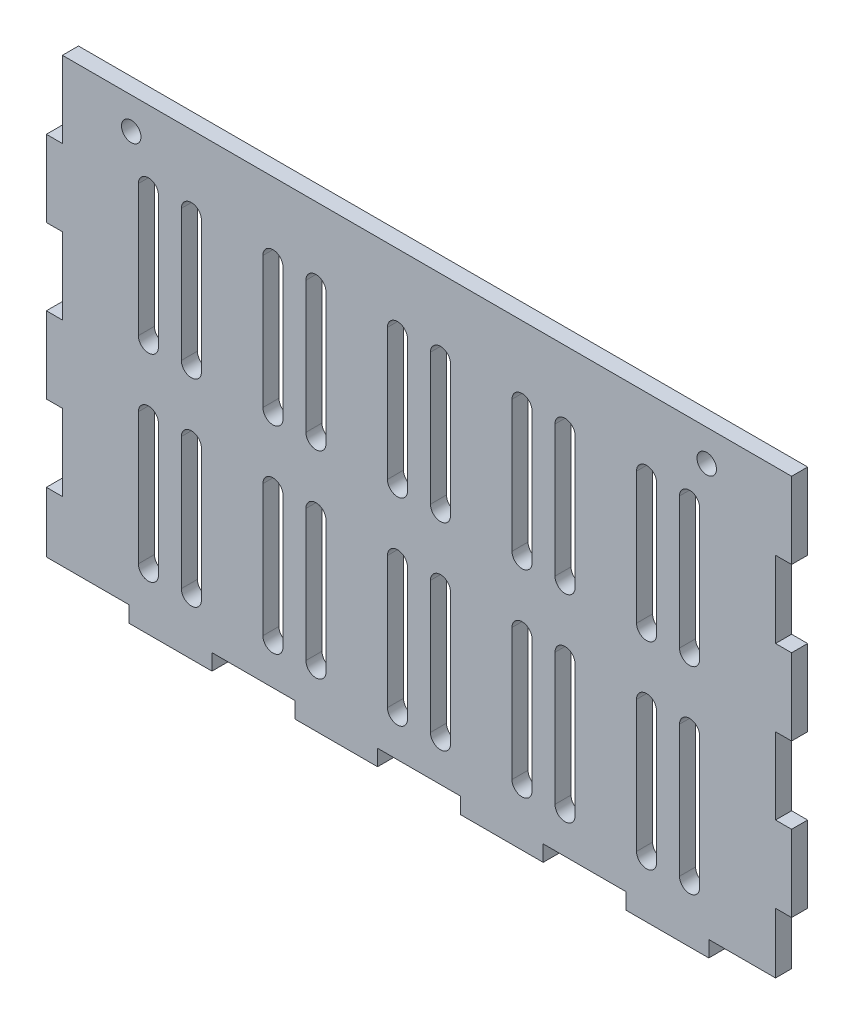
from build123d import *

# Parameters (mm, degrees)
SKETCH1_W           = 130
SKETCH1_H           = 80
BOSS_EXTRUDE1_DEPTH = 2.8
SKETCH2_W           = 14.444444444
SKETCH2_H           = 2.8
SKETCH2_W_2         = 2.8
SKETCH2_H_2         = 13.333333334
SKETCH2_H_3         = 13.333333333
CUT_EXTRUDE1_DEPTH  = 153.669053839
CUT_EXTRUDE2_REACH  = 154.669
SKETCH3_R           = 1.7
CUT_EXTRUDE3_REACH  = 154.669


with BuildPart() as part:
    # Sketch1 → Boss-Extrude1 (new body)
    with BuildSketch(Plane.XY):
        with Locations((65, 40)):
            Rectangle(SKETCH1_W, SKETCH1_H)
    extrude(amount=BOSS_EXTRUDE1_DEPTH)

    # Sketch2 → Cut-Extrude1 (cut, through all)
    with BuildSketch(Plane.XY.offset(2.8)):
        with Locations((7.222222222, 1.4)):
            Rectangle(SKETCH2_W, SKETCH2_H)
        with Locations((36.111111111, 1.4)):
            Rectangle(SKETCH2_W, SKETCH2_H)
        with Locations((65, 1.4)):
            Rectangle(SKETCH2_W, SKETCH2_H)
        with Locations((93.888888889, 1.4)):
            Rectangle(SKETCH2_W, SKETCH2_H)
        Polygon((115.555555556, 0), (115.555555556, 2.8), (127.2, 2.8), (127.2, 13.333333333), (130, 13.333333333), (130, 0), align=None)
        with Locations((1.4, 20)):
            Rectangle(SKETCH2_W_2, SKETCH2_H_2)
        with Locations((1.4, 46.666666667)):
            Rectangle(SKETCH2_W_2, SKETCH2_H_3)
        with Locations((1.4, 73.333333334)):
            Rectangle(SKETCH2_W_2, SKETCH2_H_3)
        with Locations((128.6, 33.333333334)):
            Rectangle(SKETCH2_W_2, SKETCH2_H_3)
        with Locations((128.6, 60)):
            Rectangle(SKETCH2_W_2, SKETCH2_H_2)
    extrude(amount=-CUT_EXTRUDE1_DEPTH, mode=Mode.SUBTRACT)

    # Sketch3 → Cut-Extrude2 (cut, up to next)
    with BuildSketch(Plane.XY.offset(2.8), mode=Mode.PRIVATE) as cut_extrude2_sk1:
        with Locations((14.8, 74.5)):
            Circle(SKETCH3_R)
    cut_extrude2_tool1 = extrude(cut_extrude2_sk1.sketch, amount=-CUT_EXTRUDE2_REACH, mode=Mode.PRIVATE) & part.part
    # Sketch3 → Cut-Extrude2 (cut, up to next)
    with BuildSketch(Plane.XY.offset(2.8), mode=Mode.PRIVATE) as cut_extrude2_sk2:
        with Locations(Location((115.2, 74.5, 0), (0, 0, 180))):
            Circle(SKETCH3_R)
    cut_extrude2_tool2 = extrude(cut_extrude2_sk2.sketch, amount=-CUT_EXTRUDE2_REACH, mode=Mode.PRIVATE) & part.part
    add(cut_extrude2_tool1.solids().sort_by_distance((14.8, 74.5, 2.8))[0], mode=Mode.SUBTRACT)
    add(cut_extrude2_tool2.solids().sort_by_distance((115.2, 74.5, 2.8))[0], mode=Mode.SUBTRACT)

    # Sketch4 → Cut-Extrude3 (cut, up to next)
    with BuildSketch(Plane.XY.offset(2.8), mode=Mode.PRIVATE) as cut_extrude3_sk1:
        with BuildLine():
            Line((16.05, 9.8), (16.05, 32.775))
            ThreePointArc((16.05, 32.775), (17.8, 34.525), (19.55, 32.775))
            Line((19.55, 32.775), (19.55, 9.8))
            ThreePointArc((19.55, 9.8), (17.8, 8.05), (16.05, 9.8))
        make_face()
    cut_extrude3_tool1 = extrude(cut_extrude3_sk1.sketch, amount=-CUT_EXTRUDE3_REACH, mode=Mode.PRIVATE) & part.part
    # Sketch4 → Cut-Extrude3 (cut, up to next)
    with BuildSketch(Plane.XY.offset(2.8), mode=Mode.PRIVATE) as cut_extrude3_sk2:
        with BuildLine():
            Line((16.05, 44.275), (16.05, 67.25))
            ThreePointArc((16.05, 67.25), (17.8, 69), (19.55, 67.25))
            Line((19.55, 67.25), (19.55, 44.275))
            ThreePointArc((19.55, 44.275), (17.8, 42.525), (16.05, 44.275))
        make_face()
    cut_extrude3_tool2 = extrude(cut_extrude3_sk2.sketch, amount=-CUT_EXTRUDE3_REACH, mode=Mode.PRIVATE) & part.part
    # Sketch4 → Cut-Extrude3 (cut, up to next)
    with BuildSketch(Plane.XY.offset(2.8), mode=Mode.PRIVATE) as cut_extrude3_sk3:
        with BuildLine():
            Line((23.55, 9.8), (23.55, 32.775))
            ThreePointArc((23.55, 32.775), (25.3, 34.525), (27.05, 32.775))
            Line((27.05, 32.775), (27.05, 9.8))
            ThreePointArc((27.05, 9.8), (25.3, 8.05), (23.55, 9.8))
        make_face()
    cut_extrude3_tool3 = extrude(cut_extrude3_sk3.sketch, amount=-CUT_EXTRUDE3_REACH, mode=Mode.PRIVATE) & part.part
    # Sketch4 → Cut-Extrude3 (cut, up to next)
    with BuildSketch(Plane.XY.offset(2.8), mode=Mode.PRIVATE) as cut_extrude3_sk4:
        with BuildLine():
            Line((23.55, 44.275), (23.55, 67.25))
            ThreePointArc((23.55, 67.25), (25.3, 69), (27.05, 67.25))
            Line((27.05, 67.25), (27.05, 44.275))
            ThreePointArc((27.05, 44.275), (25.3, 42.525), (23.55, 44.275))
        make_face()
    cut_extrude3_tool4 = extrude(cut_extrude3_sk4.sketch, amount=-CUT_EXTRUDE3_REACH, mode=Mode.PRIVATE) & part.part
    # Sketch4 → Cut-Extrude3 (cut, up to next)
    with BuildSketch(Plane.XY.offset(2.8), mode=Mode.PRIVATE) as cut_extrude3_sk5:
        with BuildLine():
            Line((41.275, 9.8), (41.275, 32.775))
            ThreePointArc((41.275, 32.775), (39.525, 34.525), (37.775, 32.775))
            Line((37.775, 32.775), (37.775, 9.8))
            ThreePointArc((37.775, 9.8), (39.525, 8.05), (41.275, 9.8))
        make_face()
    cut_extrude3_tool5 = extrude(cut_extrude3_sk5.sketch, amount=-CUT_EXTRUDE3_REACH, mode=Mode.PRIVATE) & part.part
    # Sketch4 → Cut-Extrude3 (cut, up to next)
    with BuildSketch(Plane.XY.offset(2.8), mode=Mode.PRIVATE) as cut_extrude3_sk6:
        with BuildLine():
            Line((48.775, 9.8), (48.775, 32.775))
            ThreePointArc((48.775, 32.775), (47.025, 34.525), (45.275, 32.775))
            Line((45.275, 32.775), (45.275, 9.8))
            ThreePointArc((45.275, 9.8), (47.025, 8.05), (48.775, 9.8))
        make_face()
    cut_extrude3_tool6 = extrude(cut_extrude3_sk6.sketch, amount=-CUT_EXTRUDE3_REACH, mode=Mode.PRIVATE) & part.part
    # Sketch4 → Cut-Extrude3 (cut, up to next)
    with BuildSketch(Plane.XY.offset(2.8), mode=Mode.PRIVATE) as cut_extrude3_sk7:
        with BuildLine():
            Line((48.775, 44.275), (48.775, 67.25))
            ThreePointArc((48.775, 67.25), (47.025, 69), (45.275, 67.25))
            Line((45.275, 67.25), (45.275, 44.275))
            ThreePointArc((45.275, 44.275), (47.025, 42.525), (48.775, 44.275))
        make_face()
    cut_extrude3_tool7 = extrude(cut_extrude3_sk7.sketch, amount=-CUT_EXTRUDE3_REACH, mode=Mode.PRIVATE) & part.part
    # Sketch4 → Cut-Extrude3 (cut, up to next)
    with BuildSketch(Plane.XY.offset(2.8), mode=Mode.PRIVATE) as cut_extrude3_sk8:
        with BuildLine():
            Line((41.275, 44.275), (41.275, 67.25))
            ThreePointArc((41.275, 67.25), (39.525, 69), (37.775, 67.25))
            Line((37.775, 67.25), (37.775, 44.275))
            ThreePointArc((37.775, 44.275), (39.525, 42.525), (41.275, 44.275))
        make_face()
    cut_extrude3_tool8 = extrude(cut_extrude3_sk8.sketch, amount=-CUT_EXTRUDE3_REACH, mode=Mode.PRIVATE) & part.part
    # Sketch4 → Cut-Extrude3 (cut, up to next)
    with BuildSketch(Plane.XY.offset(2.8), mode=Mode.PRIVATE) as cut_extrude3_sk9:
        with BuildLine():
            Line((63, 9.8), (63, 32.775))
            ThreePointArc((63, 32.775), (61.25, 34.525), (59.5, 32.775))
            Line((59.5, 32.775), (59.5, 9.8))
            ThreePointArc((59.5, 9.8), (61.25, 8.05), (63, 9.8))
        make_face()
    cut_extrude3_tool9 = extrude(cut_extrude3_sk9.sketch, amount=-CUT_EXTRUDE3_REACH, mode=Mode.PRIVATE) & part.part
    # Sketch4 → Cut-Extrude3 (cut, up to next)
    with BuildSketch(Plane.XY.offset(2.8), mode=Mode.PRIVATE) as cut_extrude3_sk10:
        with BuildLine():
            Line((70.5, 9.8), (70.5, 32.775))
            ThreePointArc((70.5, 32.775), (68.75, 34.525), (67, 32.775))
            Line((67, 32.775), (67, 9.8))
            ThreePointArc((67, 9.8), (68.75, 8.05), (70.5, 9.8))
        make_face()
    cut_extrude3_tool10 = extrude(cut_extrude3_sk10.sketch, amount=-CUT_EXTRUDE3_REACH, mode=Mode.PRIVATE) & part.part
    # Sketch4 → Cut-Extrude3 (cut, up to next)
    with BuildSketch(Plane.XY.offset(2.8), mode=Mode.PRIVATE) as cut_extrude3_sk11:
        with BuildLine():
            Line((70.5, 44.275), (70.5, 67.25))
            ThreePointArc((70.5, 67.25), (68.75, 69), (67, 67.25))
            Line((67, 67.25), (67, 44.275))
            ThreePointArc((67, 44.275), (68.75, 42.525), (70.5, 44.275))
        make_face()
    cut_extrude3_tool11 = extrude(cut_extrude3_sk11.sketch, amount=-CUT_EXTRUDE3_REACH, mode=Mode.PRIVATE) & part.part
    # Sketch4 → Cut-Extrude3 (cut, up to next)
    with BuildSketch(Plane.XY.offset(2.8), mode=Mode.PRIVATE) as cut_extrude3_sk12:
        with BuildLine():
            Line((63, 44.275), (63, 67.25))
            ThreePointArc((63, 67.25), (61.25, 69), (59.5, 67.25))
            Line((59.5, 67.25), (59.5, 44.275))
            ThreePointArc((59.5, 44.275), (61.25, 42.525), (63, 44.275))
        make_face()
    cut_extrude3_tool12 = extrude(cut_extrude3_sk12.sketch, amount=-CUT_EXTRUDE3_REACH, mode=Mode.PRIVATE) & part.part
    # Sketch4 → Cut-Extrude3 (cut, up to next)
    with BuildSketch(Plane.XY.offset(2.8), mode=Mode.PRIVATE) as cut_extrude3_sk13:
        with BuildLine():
            Line((84.725, 9.8), (84.725, 32.775))
            ThreePointArc((84.725, 32.775), (82.975, 34.525), (81.225, 32.775))
            Line((81.225, 32.775), (81.225, 9.8))
            ThreePointArc((81.225, 9.8), (82.975, 8.05), (84.725, 9.8))
        make_face()
    cut_extrude3_tool13 = extrude(cut_extrude3_sk13.sketch, amount=-CUT_EXTRUDE3_REACH, mode=Mode.PRIVATE) & part.part
    # Sketch4 → Cut-Extrude3 (cut, up to next)
    with BuildSketch(Plane.XY.offset(2.8), mode=Mode.PRIVATE) as cut_extrude3_sk14:
        with BuildLine():
            Line((92.225, 9.8), (92.225, 32.775))
            ThreePointArc((92.225, 32.775), (90.475, 34.525), (88.725, 32.775))
            Line((88.725, 32.775), (88.725, 9.8))
            ThreePointArc((88.725, 9.8), (90.475, 8.05), (92.225, 9.8))
        make_face()
    cut_extrude3_tool14 = extrude(cut_extrude3_sk14.sketch, amount=-CUT_EXTRUDE3_REACH, mode=Mode.PRIVATE) & part.part
    # Sketch4 → Cut-Extrude3 (cut, up to next)
    with BuildSketch(Plane.XY.offset(2.8), mode=Mode.PRIVATE) as cut_extrude3_sk15:
        with BuildLine():
            Line((92.225, 44.275), (92.225, 67.25))
            ThreePointArc((92.225, 67.25), (90.475, 69), (88.725, 67.25))
            Line((88.725, 67.25), (88.725, 44.275))
            ThreePointArc((88.725, 44.275), (90.475, 42.525), (92.225, 44.275))
        make_face()
    cut_extrude3_tool15 = extrude(cut_extrude3_sk15.sketch, amount=-CUT_EXTRUDE3_REACH, mode=Mode.PRIVATE) & part.part
    # Sketch4 → Cut-Extrude3 (cut, up to next)
    with BuildSketch(Plane.XY.offset(2.8), mode=Mode.PRIVATE) as cut_extrude3_sk16:
        with BuildLine():
            Line((84.725, 44.275), (84.725, 67.25))
            ThreePointArc((84.725, 67.25), (82.975, 69), (81.225, 67.25))
            Line((81.225, 67.25), (81.225, 44.275))
            ThreePointArc((81.225, 44.275), (82.975, 42.525), (84.725, 44.275))
        make_face()
    cut_extrude3_tool16 = extrude(cut_extrude3_sk16.sketch, amount=-CUT_EXTRUDE3_REACH, mode=Mode.PRIVATE) & part.part
    # Sketch4 → Cut-Extrude3 (cut, up to next)
    with BuildSketch(Plane.XY.offset(2.8), mode=Mode.PRIVATE) as cut_extrude3_sk17:
        with BuildLine():
            Line((106.45, 9.8), (106.45, 32.775))
            ThreePointArc((106.45, 32.775), (104.7, 34.525), (102.95, 32.775))
            Line((102.95, 32.775), (102.95, 9.8))
            ThreePointArc((102.95, 9.8), (104.7, 8.05), (106.45, 9.8))
        make_face()
    cut_extrude3_tool17 = extrude(cut_extrude3_sk17.sketch, amount=-CUT_EXTRUDE3_REACH, mode=Mode.PRIVATE) & part.part
    # Sketch4 → Cut-Extrude3 (cut, up to next)
    with BuildSketch(Plane.XY.offset(2.8), mode=Mode.PRIVATE) as cut_extrude3_sk18:
        with BuildLine():
            Line((113.95, 9.8), (113.95, 32.775))
            ThreePointArc((113.95, 32.775), (112.2, 34.525), (110.45, 32.775))
            Line((110.45, 32.775), (110.45, 9.8))
            ThreePointArc((110.45, 9.8), (112.2, 8.05), (113.95, 9.8))
        make_face()
    cut_extrude3_tool18 = extrude(cut_extrude3_sk18.sketch, amount=-CUT_EXTRUDE3_REACH, mode=Mode.PRIVATE) & part.part
    # Sketch4 → Cut-Extrude3 (cut, up to next)
    with BuildSketch(Plane.XY.offset(2.8), mode=Mode.PRIVATE) as cut_extrude3_sk19:
        with BuildLine():
            Line((113.95, 44.275), (113.95, 67.25))
            ThreePointArc((113.95, 67.25), (112.2, 69), (110.45, 67.25))
            Line((110.45, 67.25), (110.45, 44.275))
            ThreePointArc((110.45, 44.275), (112.2, 42.525), (113.95, 44.275))
        make_face()
    cut_extrude3_tool19 = extrude(cut_extrude3_sk19.sketch, amount=-CUT_EXTRUDE3_REACH, mode=Mode.PRIVATE) & part.part
    # Sketch4 → Cut-Extrude3 (cut, up to next)
    with BuildSketch(Plane.XY.offset(2.8), mode=Mode.PRIVATE) as cut_extrude3_sk20:
        with BuildLine():
            Line((106.45, 44.275), (106.45, 67.25))
            ThreePointArc((106.45, 67.25), (104.7, 69), (102.95, 67.25))
            Line((102.95, 67.25), (102.95, 44.275))
            ThreePointArc((102.95, 44.275), (104.7, 42.525), (106.45, 44.275))
        make_face()
    cut_extrude3_tool20 = extrude(cut_extrude3_sk20.sketch, amount=-CUT_EXTRUDE3_REACH, mode=Mode.PRIVATE) & part.part
    add(cut_extrude3_tool1.solids().sort_by_distance((17.8, 21.2875, 2.8))[0], mode=Mode.SUBTRACT)
    add(cut_extrude3_tool2.solids().sort_by_distance((17.8, 55.7625, 2.8))[0], mode=Mode.SUBTRACT)
    add(cut_extrude3_tool3.solids().sort_by_distance((25.3, 21.2875, 2.8))[0], mode=Mode.SUBTRACT)
    add(cut_extrude3_tool4.solids().sort_by_distance((25.3, 55.7625, 2.8))[0], mode=Mode.SUBTRACT)
    add(cut_extrude3_tool5.solids().sort_by_distance((39.525, 21.2875, 2.8))[0], mode=Mode.SUBTRACT)
    add(cut_extrude3_tool6.solids().sort_by_distance((47.025, 21.2875, 2.8))[0], mode=Mode.SUBTRACT)
    add(cut_extrude3_tool7.solids().sort_by_distance((47.025, 55.7625, 2.8))[0], mode=Mode.SUBTRACT)
    add(cut_extrude3_tool8.solids().sort_by_distance((39.525, 55.7625, 2.8))[0], mode=Mode.SUBTRACT)
    add(cut_extrude3_tool9.solids().sort_by_distance((61.25, 21.2875, 2.8))[0], mode=Mode.SUBTRACT)
    add(cut_extrude3_tool10.solids().sort_by_distance((68.75, 21.2875, 2.8))[0], mode=Mode.SUBTRACT)
    add(cut_extrude3_tool11.solids().sort_by_distance((68.75, 55.7625, 2.8))[0], mode=Mode.SUBTRACT)
    add(cut_extrude3_tool12.solids().sort_by_distance((61.25, 55.7625, 2.8))[0], mode=Mode.SUBTRACT)
    add(cut_extrude3_tool13.solids().sort_by_distance((82.975, 21.2875, 2.8))[0], mode=Mode.SUBTRACT)
    add(cut_extrude3_tool14.solids().sort_by_distance((90.475, 21.2875, 2.8))[0], mode=Mode.SUBTRACT)
    add(cut_extrude3_tool15.solids().sort_by_distance((90.475, 55.7625, 2.8))[0], mode=Mode.SUBTRACT)
    add(cut_extrude3_tool16.solids().sort_by_distance((82.975, 55.7625, 2.8))[0], mode=Mode.SUBTRACT)
    add(cut_extrude3_tool17.solids().sort_by_distance((104.7, 21.2875, 2.8))[0], mode=Mode.SUBTRACT)
    add(cut_extrude3_tool18.solids().sort_by_distance((112.2, 21.2875, 2.8))[0], mode=Mode.SUBTRACT)
    add(cut_extrude3_tool19.solids().sort_by_distance((112.2, 55.7625, 2.8))[0], mode=Mode.SUBTRACT)
    add(cut_extrude3_tool20.solids().sort_by_distance((104.7, 55.7625, 2.8))[0], mode=Mode.SUBTRACT)


solid = part.part
